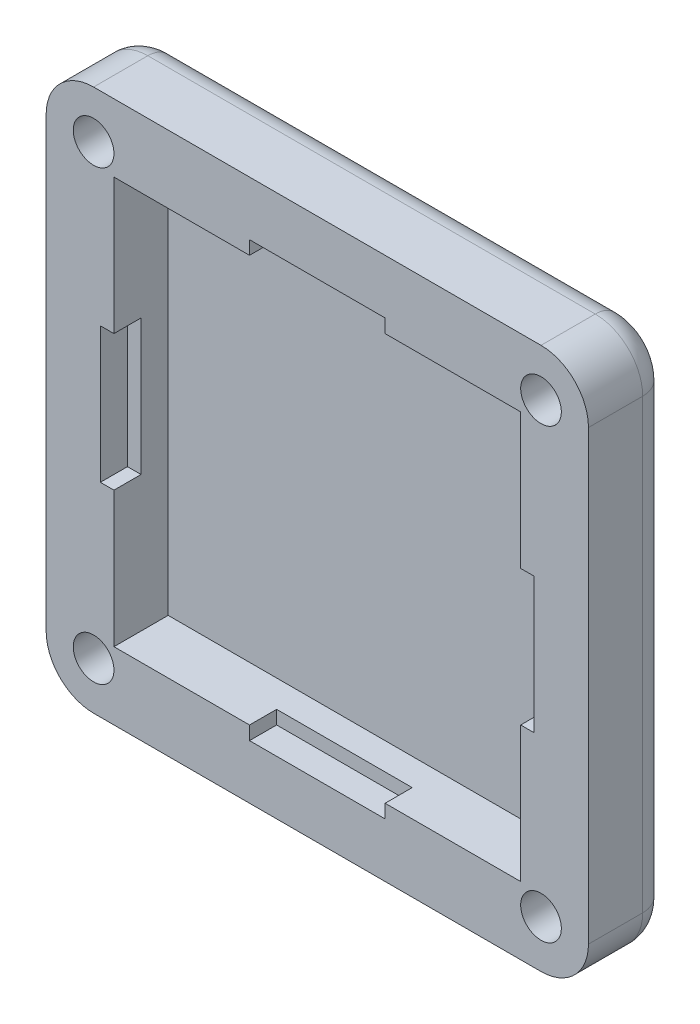
from build123d import *

# Parameters (mm, degrees)
SKETCH1_W           = 40
SKETCH1_H           = 40
BOSS_EXTRUDE1_DEPTH = 2
SKETCH2_W           = 40
SKETCH2_H           = 40
SKETCH2_W_2         = 30
SKETCH2_H_2         = 30
BOSS_EXTRUDE2_DEPTH = 2
SKETCH3_W           = 40
SKETCH3_H           = 40
SKETCH3_W_2         = 32
SKETCH3_H_2         = 32
BOSS_EXTRUDE3_DEPTH = 2
SKETCH4_R           = 1.5
CUT_EXTRUDE1_DEPTH  = 4
FILLET1_R           = 3.5
FILLET2_R           = 2


with BuildPart() as part:
    # Sketch1 → Boss-Extrude1 (new body)
    with BuildSketch(Plane.XY):
        with Locations((20, 20)):
            Rectangle(SKETCH1_W, SKETCH1_H)
    extrude(amount=BOSS_EXTRUDE1_DEPTH)

    # Sketch2 → Boss-Extrude2 (add)
    with BuildSketch(Plane.XY.offset(2)):
        with Locations((20, 20)):
            Rectangle(SKETCH2_W, SKETCH2_H)
        with Locations((20, 20)):
            Rectangle(SKETCH2_W_2, SKETCH2_H_2, mode=Mode.SUBTRACT)
    extrude(amount=BOSS_EXTRUDE2_DEPTH)

    # Sketch3 → Boss-Extrude3 (add)
    # profile 1 of 5: a face of its own
    with BuildSketch(Plane.XY.offset(4)):
        with Locations((20, 20)):
            Rectangle(SKETCH3_W, SKETCH3_H)
        with Locations((20, 20)):
            Rectangle(SKETCH3_W_2, SKETCH3_H_2, mode=Mode.SUBTRACT)
    # profile 2 of 5: a face of its own
    with BuildSketch(Plane.XY.offset(4)):
        Polygon((15, 36), (4, 36), (4, 25), (5, 25), (5, 35), (15, 35), align=None)
    # profile 3 of 5: a face of its own
    with BuildSketch(Plane.XY.offset(4)):
        Polygon((36, 36), (25, 36), (25, 35), (35, 35), (35, 25), (36, 25), align=None)
    # profile 4 of 5: a face of its own
    with BuildSketch(Plane.XY.offset(4)):
        Polygon((36, 4), (36, 15), (35, 15), (35, 5), (25, 5), (25, 4), align=None)
    # profile 5 of 5: a face of its own
    with BuildSketch(Plane.XY.offset(4)):
        Polygon((5, 15), (4, 15), (4, 4), (15, 4), (15, 5), (5, 5), align=None)
    extrude(amount=BOSS_EXTRUDE3_DEPTH)

    # Sketch4 → Cut-Extrude1 (cut)
    with BuildSketch(Plane.XY.offset(6)):
        with Locations((3.5, 36.5)):
            Circle(SKETCH4_R)
        with Locations((36.5, 36.5)):
            Circle(SKETCH4_R)
        with Locations((36.5, 3.5)):
            Circle(SKETCH4_R)
        with Locations((3.5, 3.5)):
            Circle(SKETCH4_R)
    extrude(amount=-CUT_EXTRUDE1_DEPTH, mode=Mode.SUBTRACT)

    # Fillet1
    fillet1_edges = [part.edges().sort_by_distance(p)[0] for p in [
        (0, 40, 3),
        (40, 40, 3),
        (40, 0, 3),
        (0, 0, 3),
    ]]
    fillet(fillet1_edges, radius=FILLET1_R)

    # Fillet2
    fillet2_edges = [part.edges().sort_by_distance(p)[0] for p in [
        (20, 0, 0),
        (0, 20, 0),
        (20, 40, 0),
        (40, 20, 0),
        (1.025126266, 38.974873734, 0),
        (38.974873734, 38.974873734, 0),
        (38.974873734, 1.025126266, 0),
        (1.025126266, 1.025126266, 0),
    ]]
    fillet(fillet2_edges, radius=FILLET2_R)


solid = part.part
